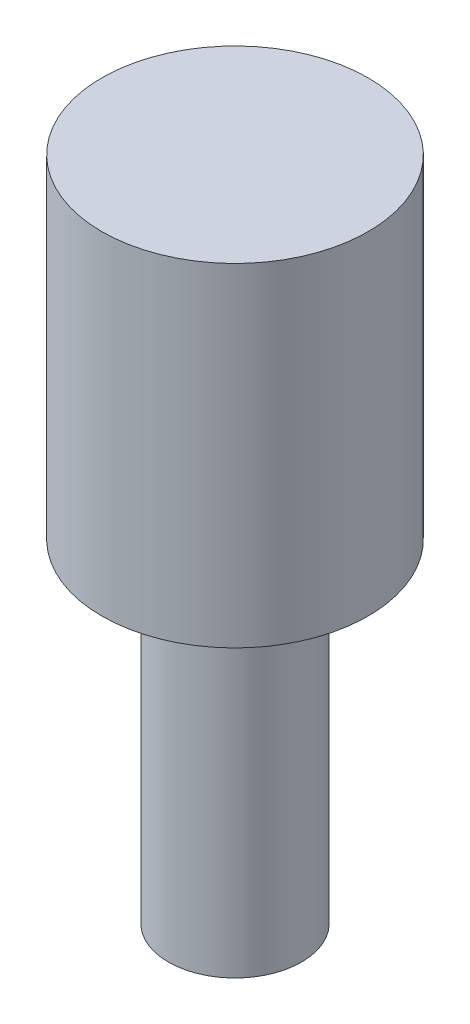
from build123d import *

# Parameters (mm, degrees)
ESQUISSE1_R        = 2
BOSS_EXTRU_1_DEPTH = 10
ESQUISSE2_R        = 4
BOSS_EXTRU_2_DEPTH = 10


with BuildPart() as part:
    # Esquisse1 → Boss.-Extru.1 (new body)
    with BuildSketch(Plane(origin=(0, 0, 0), x_dir=(1, 0, 0), z_dir=(0, 1, 0))):
        with Locations(Location((0, 0, 0), (0, 0, 270))):
            Circle(ESQUISSE1_R)
    extrude(amount=BOSS_EXTRU_1_DEPTH)

    # Esquisse2 → Boss.-Extru.2 (add)
    with BuildSketch(Plane(origin=(0, 10, 0), x_dir=(1, 0, 0), z_dir=(0, 1, 0))):
        with Locations(Location((0, 0, 0), (0, 0, 270))):
            Circle(ESQUISSE2_R)
    extrude(amount=BOSS_EXTRU_2_DEPTH)


solid = part.part
